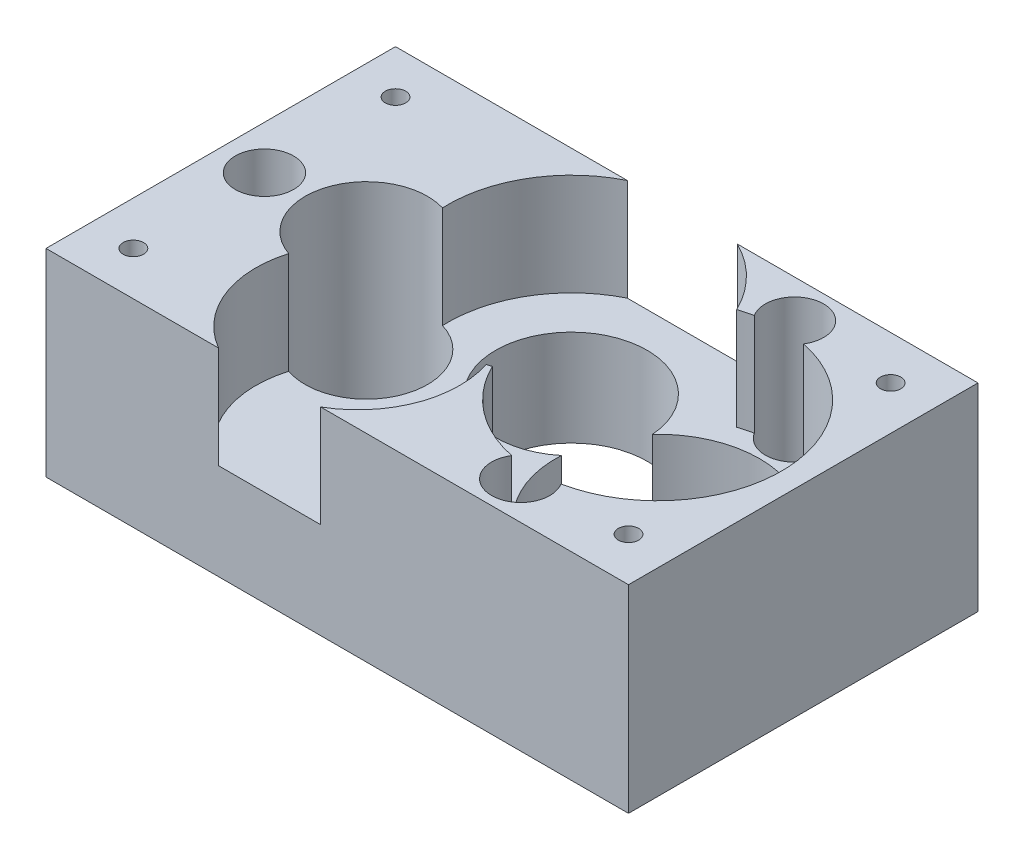
from build123d import *

# Parameters (mm, degrees)
SKETCH_1_W          = 20
SKETCH_1_H          = 12
SKETCH_1_R          = 2.1
SKETCH_1_R_2        = 0.6
EXTRUDE_1_DEPTH     = 3.3
EXTRUDE_START       = 3.3
EXTRUDE_4_DEPTH     = 3.5
SKETCH_2_R          = 0.75
CUT_EXTRUDE_1_DEPTH = 29.930952283
CUT_EXTRUDE_START   = 24
SKETCH_2_4_R        = 1
CUT_EXTRUDE_2_DEPTH = 5.8
SKETCH_3_R          = 0.35
CUT_EXTRUDE_3_DEPTH = 25.294855422


with BuildPart() as part:
    # 草图1 → 凸台-拉伸1 (new body)
    with BuildSketch(Plane(origin=(0, 0, 0), x_dir=(1, 0, 0), z_dir=(0, 1, 0))):
        with Locations((10, -6)):
            Rectangle(SKETCH_1_W, SKETCH_1_H)
        with BuildLine():
            ThreePointArc((12.439835428, -3.613463312), (18.220575086, -7.370363498), (11.50515478, -5.81011348))
            ThreePointArc((11.50515478, -5.81011348), (7.454652656, -2.789434091), (12.439835428, -3.613463312))
        make_face(mode=Mode.SUBTRACT)
        with Locations(Location((5, -6, 0), (0, 0, 270))):
            Circle(SKETCH_1_R, mode=Mode.SUBTRACT)
        with Locations(Location((7.678736094, -8.970584613, 0), (0, 0, 270))):
            Circle(SKETCH_1_R_2, mode=Mode.SUBTRACT)
    extrude(amount=EXTRUDE_1_DEPTH)

    # 草图1<6> → 凸台-拉伸4 (add)
    with BuildSketch(Plane(origin=(0, 0, 0), x_dir=(1, 0, 0), z_dir=(0, 1, 0)).offset(EXTRUDE_START)):
        with BuildLine():
            Line((7.958677072, 0), (0, 0))
            Line((0, 0), (0, -12))
            Line((0, -12), (5.925840657, -12))
            ThreePointArc((5.925840657, -12), (4.429268792, -10.270954659), (4.319841502, -7.986802561))
            ThreePointArc((4.319841502, -7.986802561), (3.000111311, -5.359340003), (5.600909971, -3.987810345))
            ThreePointArc((5.600909971, -3.987810345), (6.188678117, -1.644412009), (7.958677072, 0))
        make_face()
        with BuildLine():
            Line((20, 0), (11.735482653, 0))
            ThreePointArc((11.735482653, 0), (12.869036074, -0.819060885), (13.675372646, -1.961700559))
            ThreePointArc((13.675372646, -1.961700559), (18.910698319, -7.664012819), (11.171707216, -7.845717845))
            ThreePointArc((11.171707216, -7.845717845), (11.090844977, -7.871351024), (11.009487245, -7.895365208))
            ThreePointArc((11.009487245, -7.895365208), (10.945672327, -10.226422042), (9.43163153, -12))
            Line((9.43163153, -12), (20, -12))
            Line((20, -12), (20, 0))
        make_face()
    extrude(amount=EXTRUDE_4_DEPTH)

    # 草图2 → 切除-拉伸1 (cut, through all)
    with BuildSketch(Plane(origin=(5, -17.2, 6), x_dir=(0, 0, -1), z_dir=(0, 1, 0))):
        with Locations(Location((0, 3.5, 0), (0, 0, 180))):
            Circle(SKETCH_2_R)
        with Locations(Location((-4.7, -10, 0), (0, 0, 49.37814182))):
            Circle(SKETCH_2_R)
        with Locations(Location((4.7, -10, 0), (0, 0, 229.37814182))):
            Circle(SKETCH_2_R)
    extrude(amount=CUT_EXTRUDE_1_DEPTH, mode=Mode.SUBTRACT)

    # 草图2<4> → 切除-拉伸2 (cut)
    with BuildSketch(Plane(origin=(5, -17.2, 6), x_dir=(0, 0, -1), z_dir=(0, 1, 0)).offset(CUT_EXTRUDE_START)):
        with Locations(Location((0, 3.5, 0), (0, 0, 180))):
            Circle(SKETCH_2_4_R)
        with Locations(Location((-4.7, -10, 0), (0, 0, 180))):
            Circle(SKETCH_2_4_R)
        with Locations(Location((4.7, -10, 0), (0, 0, 180))):
            Circle(SKETCH_2_4_R)
    extrude(amount=-CUT_EXTRUDE_2_DEPTH, mode=Mode.SUBTRACT)

    # 草图3 → 切除-拉伸3 (cut, through all)
    with BuildSketch(Plane(origin=(0, 0, 0), x_dir=(1, 0, 0), z_dir=(0, 1, 0))):
        with Locations(Location((1.5, -1.5, 0), (0, 0, 270))):
            Circle(SKETCH_3_R)
        with Locations(Location((1.5, -10.5, 0), (0, 0, 270))):
            Circle(SKETCH_3_R)
        with Locations(Location((18.5, -10.5, 0), (0, 0, 270))):
            Circle(SKETCH_3_R)
        with Locations(Location((18.5, -1.5, 0), (0, 0, 270))):
            Circle(SKETCH_3_R)
    extrude(amount=CUT_EXTRUDE_3_DEPTH, mode=Mode.SUBTRACT)


solid = part.part
